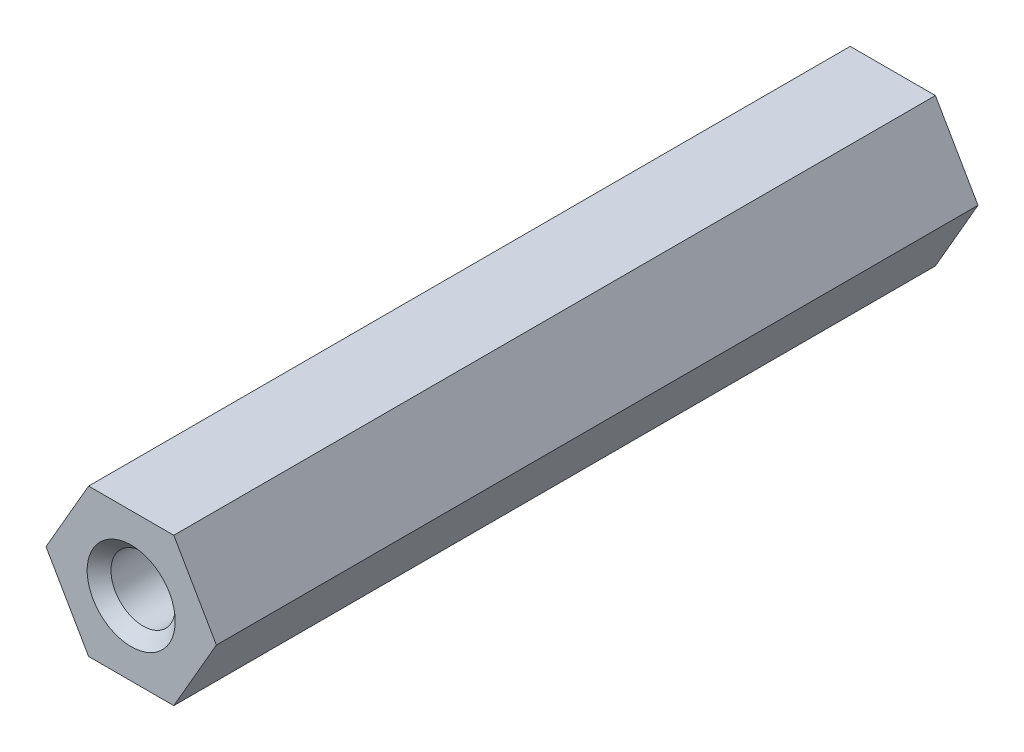
from build123d import *

# Parameters (mm, degrees)
BOSS_EXTRUDE1_DEPTH        = 32
F_2_7_2_7_DIAMETER_HOLE1_D = 2.7
CHAMFER1_SIZE              = 0.5


with BuildPart() as part:
    # Sketch1 → Boss-Extrude1 (new body)
    with BuildSketch(Plane.XY.offset(36.239504736)):
        Polygon((-24.4570858, -8.014514262), (-26.246871635, -4.914514262), (-29.826443304, -4.914514262), (-31.616229138, -8.014514262), (-29.826443304, -11.114514262), (-26.246871635, -11.114514262), align=None)
    extrude(amount=-BOSS_EXTRUDE1_DEPTH)

    # Ø2.7 (2.7) Diameter Hole1 (through all)
    with Locations(Plane.XY.offset(36.239504736)):
        with Locations((-28.036657469, -8.014514262)):
            Hole(F_2_7_2_7_DIAMETER_HOLE1_D / 2)

    # Chamfer1
    chamfer1_edges = [part.edges().sort_by_distance(p)[0] for p in [
        (-26.686657469, -8.014514262, 36.239504736),
        (-26.686657469, -8.014514262, 4.239504736),
    ]]
    chamfer(chamfer1_edges, length=CHAMFER1_SIZE)


solid = part.part
